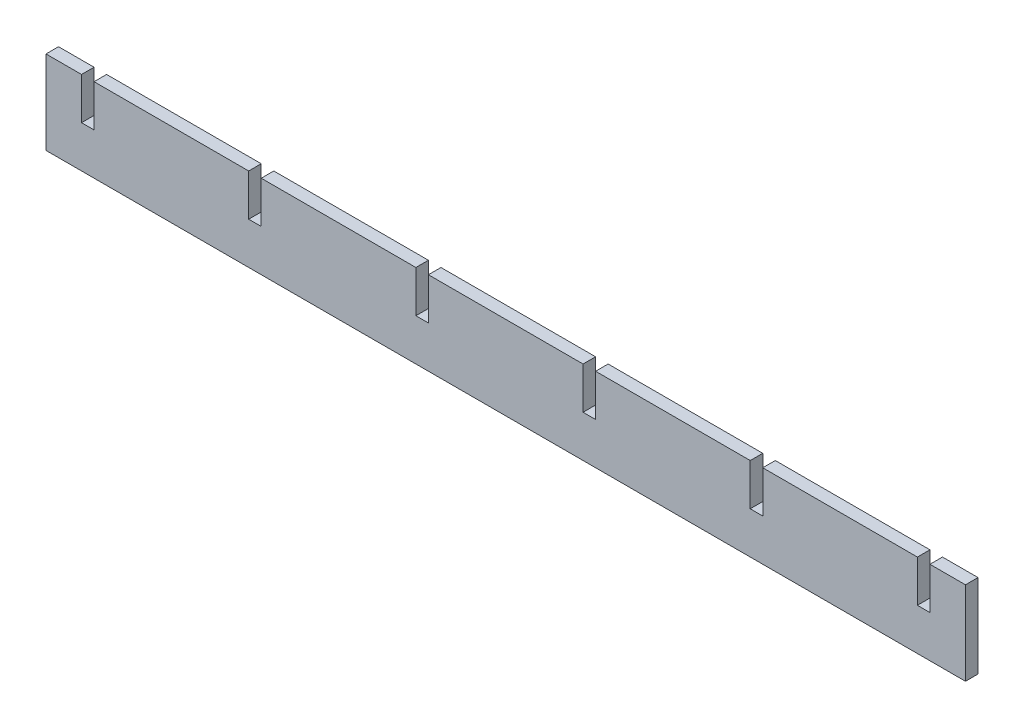
from build123d import *

# Parameters (mm, degrees)
SKETCH2_W           = 220
SKETCH2_H           = 20
BOSS_EXTRUDE1_DEPTH = 3
SKETCH4_W           = 3
SKETCH4_H           = 10
CUT_EXTRUDE2_DEPTH  = 221.927589947
LPATTERN1_COUNT     = 6
LPATTERN1_PITCH     = 40


with BuildPart() as part:
    # Sketch2 → Boss-Extrude1 (new body)
    with BuildSketch(Plane.XY):
        with Locations((110, 10)):
            Rectangle(SKETCH2_W, SKETCH2_H)
    extrude(amount=BOSS_EXTRUDE1_DEPTH)

    # Sketch4 → Cut-Extrude2 (cut, through all)
    with BuildSketch(Plane.XY):
        with Locations((10, 15)):
            Rectangle(SKETCH4_W, SKETCH4_H)
    cut_extrude2 = extrude(amount=CUT_EXTRUDE2_DEPTH, mode=Mode.SUBTRACT)

    # LPattern1: Cut-Extrude2 ×6
    with Locations(*[(i * LPATTERN1_PITCH, 0, 0) for i in range(1, LPATTERN1_COUNT)]):
        add(cut_extrude2, mode=Mode.SUBTRACT)


solid = part.part
